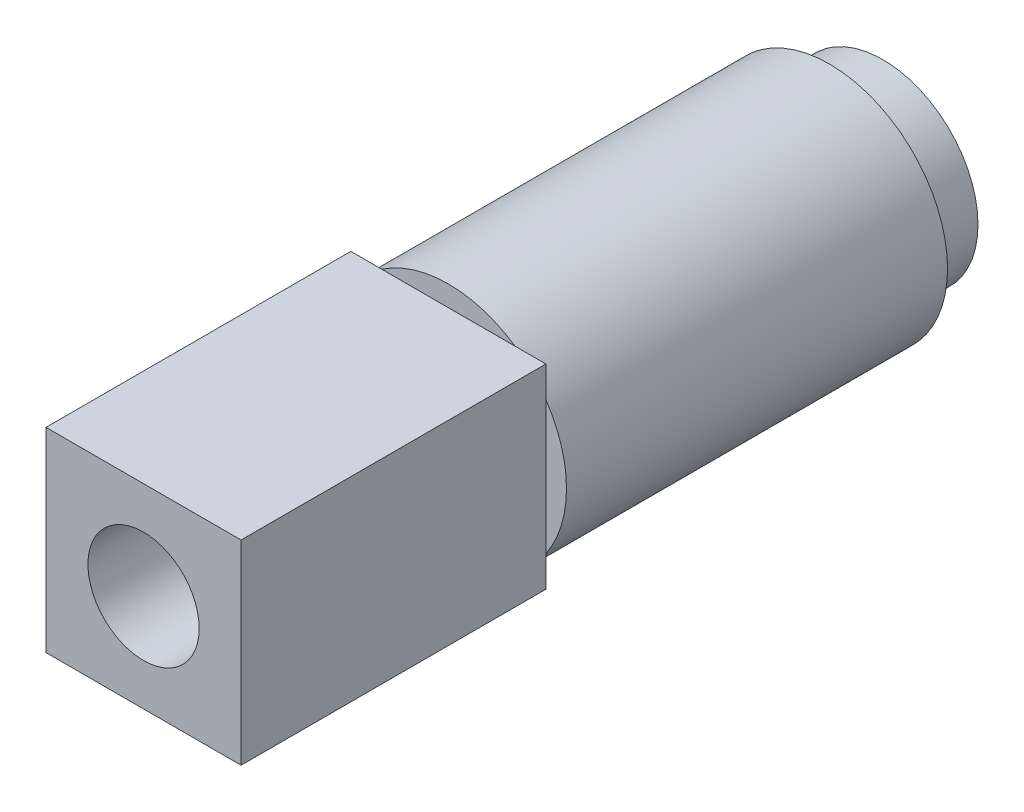
from build123d import *

# Parameters (mm, degrees)
SKETCH1_R           = 1.5875
BOSS_EXTRUDE1_DEPTH = 0.889
SKETCH2_R           = 1.9685
BOSS_EXTRUDE2_DEPTH = 6.35
SKETCH4_W           = 3.2512
SKETCH4_H           = 3.2512
BOSS_EXTRUDE3_DEPTH = 5.08
SKETCH5_R           = 0.9271
CUT_EXTRUDE1_DEPTH  = 5.08


with BuildPart() as part:
    # Sketch1 → Boss-Extrude1 (new body)
    with BuildSketch(Plane.XY):
        Circle(SKETCH1_R)
    extrude(amount=BOSS_EXTRUDE1_DEPTH)

    # Sketch2 → Boss-Extrude2 (add)
    with BuildSketch(Plane.XY.offset(0.889)):
        Circle(SKETCH2_R)
    extrude(amount=BOSS_EXTRUDE2_DEPTH)

    # Sketch4 → Boss-Extrude3 (add)
    with BuildSketch(Plane.XY.offset(7.239)):
        Rectangle(SKETCH4_W, SKETCH4_H)
    extrude(amount=BOSS_EXTRUDE3_DEPTH)

    # Sketch5 → Cut-Extrude1 (cut)
    with BuildSketch(Plane.XY.offset(12.319)):
        Circle(SKETCH5_R)
    extrude(amount=-CUT_EXTRUDE1_DEPTH, mode=Mode.SUBTRACT)


solid = part.part
